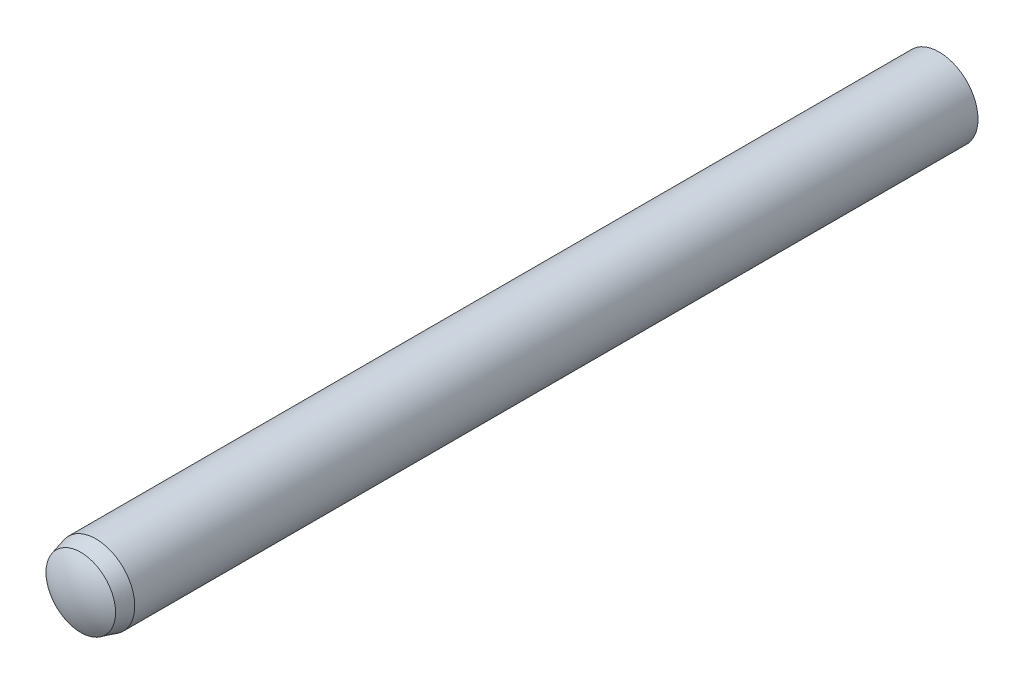
from build123d import *


with BuildPart() as part:
    # Sketch3 → Revolve1 (revolve)
    with BuildSketch(Plane(origin=(0, 0, 0), x_dir=(0, 0, -1), z_dir=(1, 0, 0))):
        with BuildLine():
            Line((-17, 0), (17, 0))
            ThreePointArc((17, 0), (16.885076627, 0.783022988), (16.55, 1.5))
            Line((16.55, 1.5), (-16.025, 1.5))
            Line((-16.025, 1.5), (-16.61, 1.343249722))
            ThreePointArc((-16.61, 1.343249722), (-16.90052754, 0.699360389), (-17, 0))
        make_face()
    revolve(axis=Axis((0, 0, 17), (0, 0, -1)))


solid = part.part
